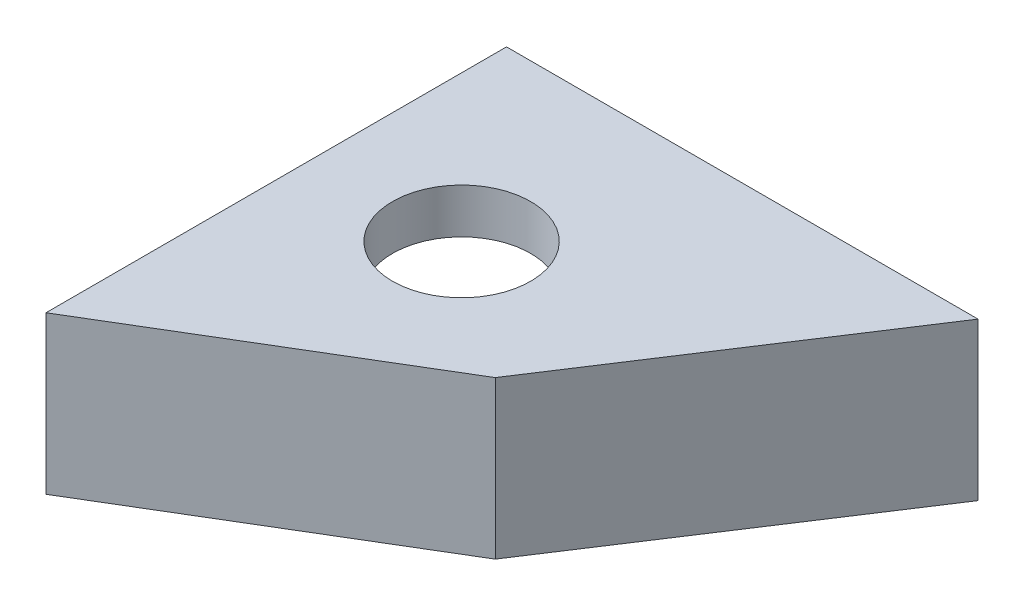
from build123d import *

# Parameters (mm, degrees)
SKETCH1_R           = 3.075
BOSS_EXTRUDE1_DEPTH = 2
BOSS_EXTRUDE2_DEPTH = 5


with BuildPart() as part:
    # Sketch1 → Boss-Extrude1 (new body)
    with BuildSketch(Plane(origin=(0, 0, 0), x_dir=(1, 0, 0), z_dir=(0, 1, 0))):
        Polygon((69.882295615, -141.15690287), (82.382295615, -133.65690287), (90.871460172, -120.65690287), (69.882295615, -120.65690287), align=None)
        with Locations(Location((76.382295615, -129.15690287, 0), (0, 0, 270))):
            Circle(SKETCH1_R, mode=Mode.SUBTRACT)
    extrude(amount=BOSS_EXTRUDE1_DEPTH)

    # Sketch2 → Boss-Extrude2 (add)
    with BuildSketch(Plane(origin=(0, 0, 0), x_dir=(-1, 0, 0), z_dir=(0, -1, 0))):
        Polygon((-69.882295615, -141.15690287), (-82.382295615, -133.65690287), (-90.871460172, -120.65690287), (-80.30000632, -131.836011395), (-74.842574052, -136.43145024), (-71.882295615, -138.207617302), (-69.882295615, -139.45690287), align=None)
    extrude(amount=BOSS_EXTRUDE2_DEPTH)


solid = part.part
